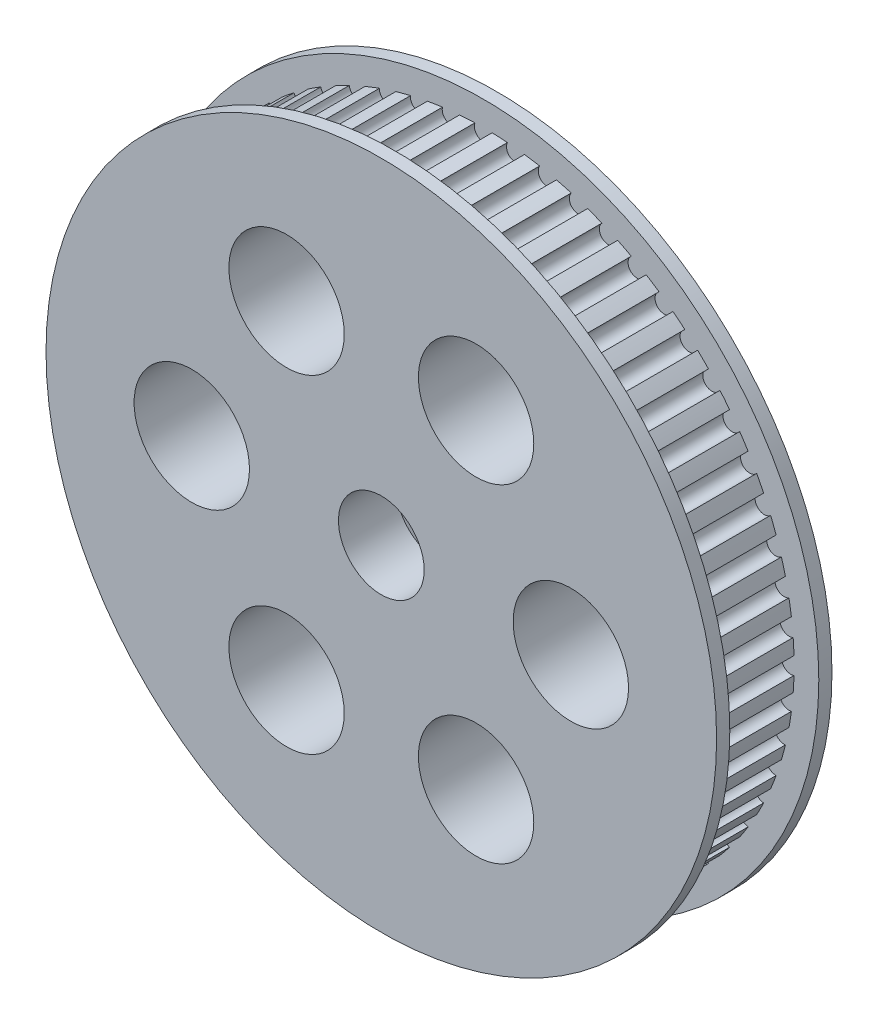
from build123d import *

# Parameters (mm, degrees)
SKETCH1_R           = 4.5
SKETCH1_R_2         = 2.6
BOSS_EXTRUDE1_DEPTH = 7.5
SKETCH2_R           = 20.344593171
SKETCH2_R_2         = 4.5
BOSS_EXTRUDE2_DEPTH = 0.8
SKETCH3_R           = 20.344593171
SKETCH3_R_2         = 4.5
BOSS_EXTRUDE3_DEPTH = 0.8
SKETCH4_R           = 18.844593171
SKETCH4_R_2         = 4.5
BOSS_EXTRUDE4_DEPTH = 5.4
SKETCH5_R           = 0.555
CUT_EXTRUDE1_DEPTH  = 5.4
CUT_EXTRUDE2_DEPTH  = 4
SKETCH7_R           = 3.5
CUT_EXTRUDE3_DEPTH  = 8


with BuildPart() as part:
    # Sketch1 → Boss-Extrude1 (new body)
    with BuildSketch(Plane.XY.offset(334)):
        with Locations((300, 170)):
            Circle(SKETCH1_R)
        with Locations((300, 170)):
            Circle(SKETCH1_R_2, mode=Mode.SUBTRACT)
    extrude(amount=BOSS_EXTRUDE1_DEPTH)

    # Sketch2 → Boss-Extrude2 (add)
    with BuildSketch(Plane.XY.offset(334.5)):
        with Locations((300, 170)):
            Circle(SKETCH2_R)
        with Locations((300, 170)):
            Circle(SKETCH2_R_2, mode=Mode.SUBTRACT)
    extrude(amount=BOSS_EXTRUDE2_DEPTH)

    # Sketch3 → Boss-Extrude3 (add)
    with BuildSketch(Plane.XY.offset(340.7)):
        with Locations((300, 170)):
            Circle(SKETCH3_R)
        with Locations((300, 170)):
            Circle(SKETCH3_R_2, mode=Mode.SUBTRACT)
    extrude(amount=BOSS_EXTRUDE3_DEPTH)

    # Sketch4 → Boss-Extrude4 (add)
    with BuildSketch(Plane.XY.offset(335.3)):
        with Locations((300, 170)):
            Circle(SKETCH4_R)
        with Locations((300, 170)):
            Circle(SKETCH4_R_2, mode=Mode.SUBTRACT)
    extrude(amount=BOSS_EXTRUDE4_DEPTH)

    # Sketch5 → Cut-Extrude1 (cut)
    with BuildSketch(Plane.XY.offset(335.3)):
        with Locations((318.649593171, 170)):
            Circle(SKETCH5_R)
        with Locations((318.547428748, 171.949413315)):
            Circle(SKETCH5_R)
        with Locations((318.242054815, 173.877468449)):
            Circle(SKETCH5_R)
        with Locations((317.736817112, 175.763041228)):
            Circle(SKETCH5_R)
        with Locations((317.037251128, 177.585472921)):
            Circle(SKETCH5_R)
        with Locations((316.151021456, 179.324796586)):
            Circle(SKETCH5_R)
        with Locations((315.087837814, 180.961955827)):
            Circle(SKETCH5_R)
        with Locations((313.859348662, 182.479013587)):
            Circle(SKETCH5_R)
        with Locations((312.479013587, 183.859348662)):
            Circle(SKETCH5_R)
        with Locations((310.961955827, 185.087837814)):
            Circle(SKETCH5_R)
        with Locations((309.324796586, 186.151021456)):
            Circle(SKETCH5_R)
        with Locations((307.585472921, 187.037251128)):
            Circle(SKETCH5_R)
        with Locations((305.763041228, 187.736817112)):
            Circle(SKETCH5_R)
        with Locations((303.877468449, 188.242054815)):
            Circle(SKETCH5_R)
        with Locations((301.949413315, 188.547428748)):
            Circle(SKETCH5_R)
        with Locations((300, 188.649593171)):
            Circle(SKETCH5_R)
        with Locations((298.050586685, 188.547428748)):
            Circle(SKETCH5_R)
        with Locations((296.122531551, 188.242054815)):
            Circle(SKETCH5_R)
        with Locations((294.236958772, 187.736817112)):
            Circle(SKETCH5_R)
        with Locations((292.414527079, 187.037251128)):
            Circle(SKETCH5_R)
        with Locations((290.675203414, 186.151021456)):
            Circle(SKETCH5_R)
        with Locations((289.038044173, 185.087837814)):
            Circle(SKETCH5_R)
        with Locations((287.520986413, 183.859348662)):
            Circle(SKETCH5_R)
        with Locations((286.140651338, 182.479013587)):
            Circle(SKETCH5_R)
        with Locations((284.912162186, 180.961955827)):
            Circle(SKETCH5_R)
        with Locations((283.848978544, 179.324796586)):
            Circle(SKETCH5_R)
        with Locations((282.962748872, 177.585472921)):
            Circle(SKETCH5_R)
        with Locations((282.263182888, 175.763041228)):
            Circle(SKETCH5_R)
        with Locations((281.757945185, 173.877468449)):
            Circle(SKETCH5_R)
        with Locations((281.452571252, 171.949413315)):
            Circle(SKETCH5_R)
        with Locations((281.350406829, 170)):
            Circle(SKETCH5_R)
        with Locations((281.452571252, 168.050586685)):
            Circle(SKETCH5_R)
        with Locations((281.757945185, 166.122531551)):
            Circle(SKETCH5_R)
        with Locations((282.263182888, 164.236958772)):
            Circle(SKETCH5_R)
        with Locations((282.962748872, 162.414527079)):
            Circle(SKETCH5_R)
        with Locations((283.848978544, 160.675203414)):
            Circle(SKETCH5_R)
        with Locations((284.912162186, 159.038044173)):
            Circle(SKETCH5_R)
        with Locations((286.140651338, 157.520986413)):
            Circle(SKETCH5_R)
        with Locations((287.520986413, 156.140651338)):
            Circle(SKETCH5_R)
        with Locations((289.038044173, 154.912162186)):
            Circle(SKETCH5_R)
        with Locations((290.675203414, 153.848978544)):
            Circle(SKETCH5_R)
        with Locations((292.414527079, 152.962748872)):
            Circle(SKETCH5_R)
        with Locations((294.236958772, 152.263182888)):
            Circle(SKETCH5_R)
        with Locations((296.122531551, 151.757945185)):
            Circle(SKETCH5_R)
        with Locations((298.050586685, 151.452571252)):
            Circle(SKETCH5_R)
        with Locations((300, 151.350406829)):
            Circle(SKETCH5_R)
        with Locations((301.949413315, 151.452571252)):
            Circle(SKETCH5_R)
        with Locations((303.877468449, 151.757945185)):
            Circle(SKETCH5_R)
        with Locations((305.763041228, 152.263182888)):
            Circle(SKETCH5_R)
        with Locations((307.585472921, 152.962748872)):
            Circle(SKETCH5_R)
        with Locations((309.324796586, 153.848978544)):
            Circle(SKETCH5_R)
        with Locations((310.961955827, 154.912162186)):
            Circle(SKETCH5_R)
        with Locations((312.479013587, 156.140651338)):
            Circle(SKETCH5_R)
        with Locations((313.859348662, 157.520986413)):
            Circle(SKETCH5_R)
        with Locations((315.087837814, 159.038044173)):
            Circle(SKETCH5_R)
        with Locations((316.151021456, 160.675203414)):
            Circle(SKETCH5_R)
        with Locations((317.037251128, 162.414527079)):
            Circle(SKETCH5_R)
        with Locations((317.736817112, 164.236958772)):
            Circle(SKETCH5_R)
        with Locations((318.242054815, 166.122531551)):
            Circle(SKETCH5_R)
        with Locations((318.547428748, 168.050586685)):
            Circle(SKETCH5_R)
    extrude(amount=CUT_EXTRUDE1_DEPTH, mode=Mode.SUBTRACT)

    # Sketch6 → Cut-Extrude2 (cut)
    with BuildSketch(Plane.XY.offset(334)):
        Polygon((304.734272207, 170), (302.367136104, 174.1), (297.632863896, 174.1), (295.265727793, 170), (297.632863896, 165.9), (302.367136104, 165.9), align=None)
    extrude(amount=CUT_EXTRUDE2_DEPTH, mode=Mode.SUBTRACT)

    # Sketch7 → Cut-Extrude3 (cut)
    with BuildSketch(Plane.XY.offset(334)):
        with Locations((311.5, 170)):
            Circle(SKETCH7_R)
        with Locations((305.75, 179.959292144)):
            Circle(SKETCH7_R)
        with Locations((294.25, 179.959292144)):
            Circle(SKETCH7_R)
        with Locations((288.5, 170)):
            Circle(SKETCH7_R)
        with Locations((294.25, 160.040707856)):
            Circle(SKETCH7_R)
        with Locations((305.75, 160.040707856)):
            Circle(SKETCH7_R)
    extrude(amount=CUT_EXTRUDE3_DEPTH, mode=Mode.SUBTRACT)


solid = part.part
